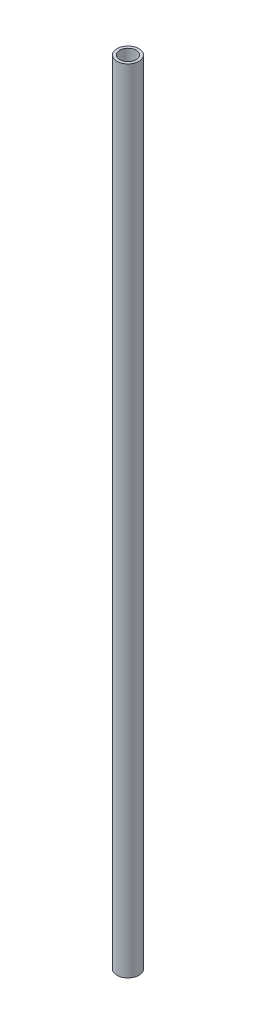
from build123d import *

# Parameters (mm, degrees)
SKETCH1_R           = 6.35
SKETCH1_R_2         = 4.7625
BOSS_EXTRUDE1_DEPTH = 457.2


with BuildPart() as part:
    # Sketch1 → Boss-Extrude1 (new body)
    with BuildSketch(Plane(origin=(0, 0, 0), x_dir=(1, 0, 0), z_dir=(0, 1, 0))):
        with Locations(Location((0, 0, 0), (0, 0, 270))):
            Circle(SKETCH1_R)
        with Locations(Location((0, 0, 0), (0, 0, 270))):
            Circle(SKETCH1_R_2, mode=Mode.SUBTRACT)
    extrude(amount=BOSS_EXTRUDE1_DEPTH)


solid = part.part
